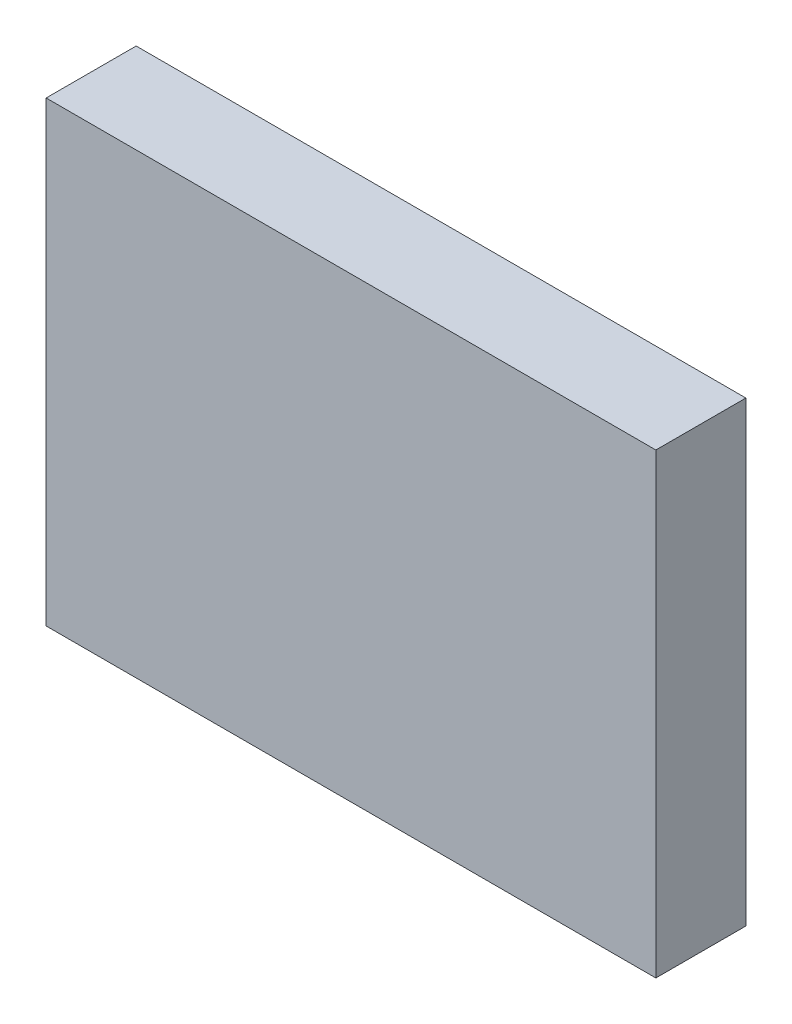
from build123d import *

# Parameters (mm, degrees)
SKETCH_1_W      = 101.6
SKETCH_1_H      = 76.2
EXTRUDE_1_DEPTH = 15


with BuildPart() as part:
    # 草图1 → 凸台-拉伸1 (new body)
    with BuildSketch(Plane.XY):
        with Locations((50.8, -38.1)):
            Rectangle(SKETCH_1_W, SKETCH_1_H)
    extrude(amount=EXTRUDE_1_DEPTH)


solid = part.part
